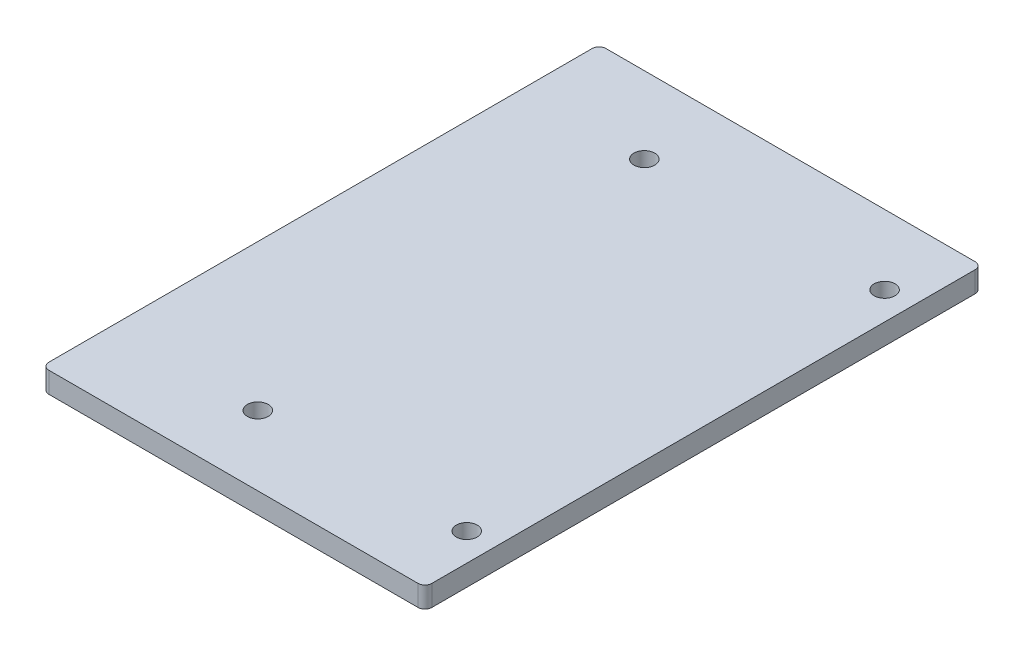
from build123d import *

# Parameters (mm, degrees)
SKETCH_1_W      = 55
SKETCH_1_H      = 80
SKETCH_1_R      = 1.5
EXTRUDE_1_DEPTH = 3
FILLET_1_R      = 1


with BuildPart() as part:
    # 草图1 → 凸台-拉伸1 (new body)
    with BuildSketch(Plane(origin=(0, 0, 0), x_dir=(1, 0, 0), z_dir=(0, 1, 0))):
        with Locations((27.5, -40)):
            Rectangle(SKETCH_1_W, SKETCH_1_H)
        with Locations(Location((17.5, -11, 0), (0, 0, 270))):
            Circle(SKETCH_1_R, mode=Mode.SUBTRACT)
        with Locations(Location((51, -10, 0), (0, 0, 270))):
            Circle(SKETCH_1_R, mode=Mode.SUBTRACT)
        with Locations(Location((21, -70, 0), (0, 0, 270))):
            Circle(SKETCH_1_R, mode=Mode.SUBTRACT)
        with Locations(Location((51, -70, 0), (0, 0, 270))):
            Circle(SKETCH_1_R, mode=Mode.SUBTRACT)
    extrude(amount=EXTRUDE_1_DEPTH)

    # 圆角1
    fillet_1_edges = [part.edges().sort_by_distance(p)[0] for p in [
        (0, 1.5, 0),
        (55, 1.5, 0),
        (55, 1.5, 80),
        (0, 1.5, 80),
    ]]
    fillet(fillet_1_edges, radius=FILLET_1_R)


solid = part.part
